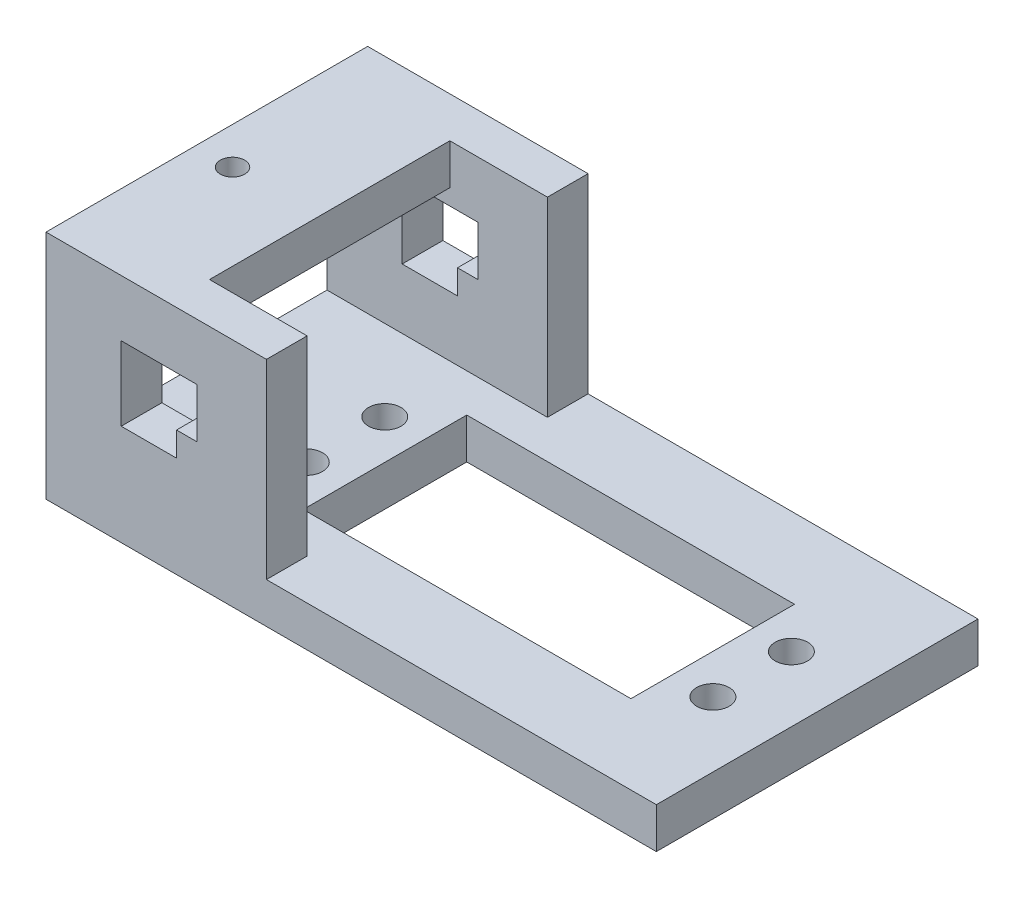
from build123d import *

# Parameters (mm, degrees)
SKETCH1_R           = 2
SKETCH1_W           = 40
SKETCH1_H           = 19.81
BOSS_EXTRUDE1_DEPTH = 5
SKETCH2_W           = 23.106523906
SKETCH2_H           = 5
BOSS_EXTRUDE2_DEPTH = 18.45
SKETCH3_W           = 23.106523906
SKETCH3_H           = 5
BOSS_EXTRUDE3_DEPTH = 39.55
CUT_EXTRUDE1_START  = -39.55
CUT_EXTRUDE1_DEPTH  = 39.55
SKETCH6_W           = 12
SKETCH6_H           = 29.55
CUT_EXTRUDE2_DEPTH  = 23.45
CUT_EXTRUDE3_START  = -39.55
CUT_EXTRUDE3_DEPTH  = 39.55
SKETCH9_W           = 39.55
SKETCH9_H           = 28.45
SKETCH9_W_2         = 29.55
SKETCH9_H_2         = 18.45
BOSS_EXTRUDE4_DEPTH = 4
SKETCH11_W          = 39.55
SKETCH11_H          = 5
BOSS_EXTRUDE5_DEPTH = 3
SKETCH12_W          = 40.3
SKETCH12_H          = 20.11
SKETCH12_W_2        = 40
SKETCH12_H_2        = 19.81
CUT_EXTRUDE4_DEPTH  = 5
SKETCH13_R          = 1.5
CUT_EXTRUDE5_DEPTH  = 5


with BuildPart() as part:
    # Sketch1 → Boss-Extrude1 (new body)
    with BuildSketch(Plane(origin=(0, 0, 0), x_dir=(1, 0, 0), z_dir=(0, 1, 0))):
        Polygon((32, -9.9), (32, 10.1), (32, 18.775), (32, 19.775), (31, 19.775), (-13.05, 19.775), (-27, 19.775), (-36.05, 19.775), (-36.05, -19.775), (-27, -19.775), (-13.05, -19.775), (31, -19.775), (32, -19.775), (32, -18.775), align=None)
        with Locations(Location((-23, -4.82, 0), (0, 0, 270))):
            Circle(SKETCH1_R, mode=Mode.SUBTRACT)
        with Locations(Location((-23, 4.83, 0), (0, 0, 270))):
            Circle(SKETCH1_R, mode=Mode.SUBTRACT)
        with Locations(Location((27, -4.82, 0), (0, 0, 90))):
            Circle(SKETCH1_R, mode=Mode.SUBTRACT)
        with Locations(Location((27, 4.83, 0), (0, 0, 90))):
            Circle(SKETCH1_R, mode=Mode.SUBTRACT)
        with Locations((2, 0.005)):
            Rectangle(SKETCH1_W, SKETCH1_H, mode=Mode.SUBTRACT)
    extrude(amount=BOSS_EXTRUDE1_DEPTH)

    # Sketch2 → Boss-Extrude2 (add)
    with BuildSketch(Plane(origin=(0, 5, 0), x_dir=(1, 0, 0), z_dir=(0, 1, 0))):
        with Locations((-24.496738047, -17.275)):
            Rectangle(SKETCH2_W, SKETCH2_H)
        with Locations((-24.496738047, 17.275)):
            Rectangle(SKETCH2_W, SKETCH2_H)
    extrude(amount=BOSS_EXTRUDE2_DEPTH)

    # Sketch3 → Boss-Extrude3 (add)
    with BuildSketch(Plane.XY.offset(19.775)):
        with Locations((-24.496738047, 25.95)):
            Rectangle(SKETCH3_W, SKETCH3_H)
    extrude(amount=-BOSS_EXTRUDE3_DEPTH)

    # Sketch4 → Cut-Extrude1 (cut)
    with BuildSketch(Plane.XY.offset(19.775).offset(CUT_EXTRUDE1_START)):
        Polygon((-24.05, 21.45), (-30.75, 21.45), (-30.75, 15.45), (-30.75, 12.45), (-24.05, 12.45), (-24.05, 15.45), (-21.55, 15.45), (-21.55, 21.45), align=None)
    extrude(amount=CUT_EXTRUDE1_DEPTH, mode=Mode.SUBTRACT)

    # Sketch6 → Cut-Extrude2 (cut)
    with BuildSketch(Plane(origin=(0, 5, 0), x_dir=(1, 0, 0), z_dir=(0, 1, 0))):
        with Locations((-18.943476094, 0)):
            Rectangle(SKETCH6_W, SKETCH6_H)
    extrude(amount=CUT_EXTRUDE2_DEPTH, mode=Mode.SUBTRACT)

    # Sketch7 → Cut-Extrude3 (cut)
    with BuildSketch(Plane.XY.offset(19.775).offset(CUT_EXTRUDE3_START)):
        Polygon((-24.05, 21.5), (-30.8, 21.5), (-30.8, 15.45), (-30.8, 12.4), (-24, 12.4), (-24, 15.4), (-21.5, 15.4), (-21.5, 21.5), align=None)
        Polygon((-24.05, 21.45), (-30.75, 21.45), (-30.75, 15.45), (-30.75, 12.45), (-24.05, 12.45), (-24.05, 15.45), (-21.55, 15.45), (-21.55, 21.45), align=None, mode=Mode.SUBTRACT)
    extrude(amount=CUT_EXTRUDE3_DEPTH, mode=Mode.SUBTRACT)

    # Sketch9 → Boss-Extrude4 (add)
    with BuildSketch(Plane.ZY.offset(36.05)):
        with Locations((0, 14.225)):
            Rectangle(SKETCH9_W, SKETCH9_H)
        with Locations((0, 14.225)):
            Rectangle(SKETCH9_W_2, SKETCH9_H_2, mode=Mode.SUBTRACT)
    extrude(amount=BOSS_EXTRUDE4_DEPTH)

    # Sketch11 → Boss-Extrude5 (add)
    with BuildSketch(Plane(origin=(32, 0, 0), x_dir=(0, 0, -1), z_dir=(1, 0, 0))):
        with Locations((0, 2.5)):
            Rectangle(SKETCH11_W, SKETCH11_H)
    extrude(amount=BOSS_EXTRUDE5_DEPTH)

    # Sketch12 → Cut-Extrude4 (cut)
    with BuildSketch(Plane(origin=(0, 5, 0), x_dir=(1, 0, 0), z_dir=(0, 1, 0))):
        with Locations((2, 0.005)):
            Rectangle(SKETCH12_W, SKETCH12_H)
        with Locations((2, 0.005)):
            Rectangle(SKETCH12_W_2, SKETCH12_H_2, mode=Mode.SUBTRACT)
    extrude(amount=-CUT_EXTRUDE4_DEPTH, mode=Mode.SUBTRACT)

    # Sketch13 → Cut-Extrude5 (cut)
    with BuildSketch(Plane(origin=(0, 28.45, 0), x_dir=(1, 0, 0), z_dir=(0, 1, 0))):
        with Locations(Location((-35.49673805, -1.395, 0), (0, 0, 270))):
            Circle(SKETCH13_R)
    extrude(amount=-CUT_EXTRUDE5_DEPTH, mode=Mode.SUBTRACT)


solid = part.part
